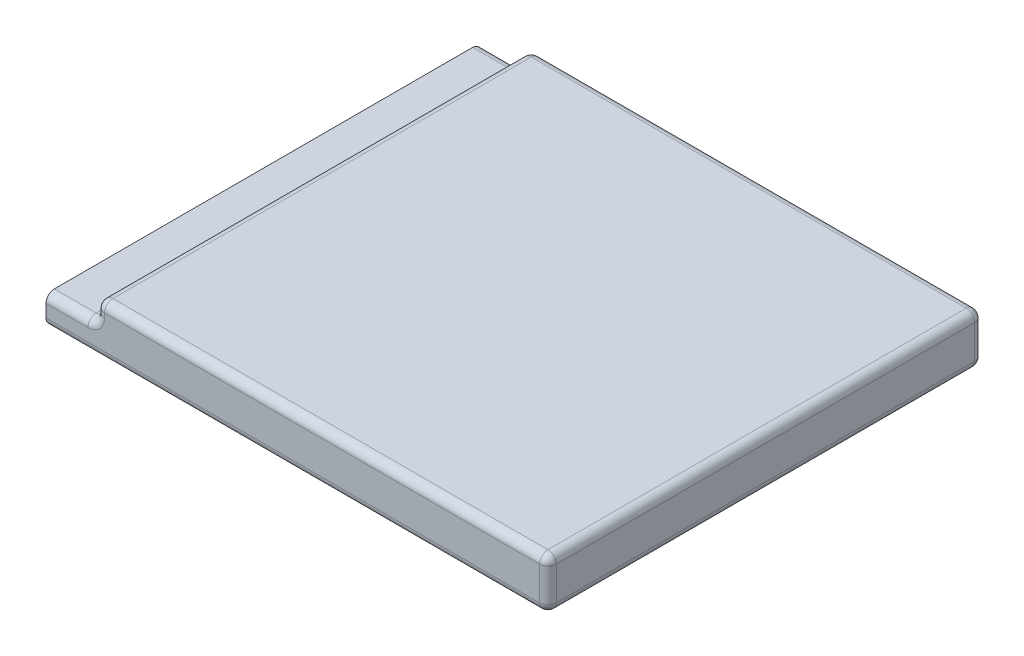
from build123d import *

# Parameters (mm, degrees)
SKETCH2_W           = 60
SKETCH2_H           = 52
BOSS_EXTRUDE1_DEPTH = 6
SKETCH3_W           = 6
SKETCH3_H           = 52
CUT_EXTRUDE1_DEPTH  = 2.5
FILLET1_R           = 1


with BuildPart() as part:
    # Sketch2 → Boss-Extrude1 (new body)
    with BuildSketch(Plane(origin=(0, 0, 0), x_dir=(1, 0, 0), z_dir=(0, 1, 0))):
        with Locations((11.121057716, -5.523608753)):
            Rectangle(SKETCH2_W, SKETCH2_H)
    extrude(amount=BOSS_EXTRUDE1_DEPTH)

    # Sketch3 → Cut-Extrude1 (cut)
    with BuildSketch(Plane(origin=(0, 6, 0), x_dir=(1, 0, 0), z_dir=(0, 1, 0))):
        with Locations((-15.878942284, -5.523608753)):
            Rectangle(SKETCH3_W, SKETCH3_H)
    extrude(amount=-CUT_EXTRUDE1_DEPTH, mode=Mode.SUBTRACT)

    # Fillet1
    fillet1_edges = [part.edges().sort_by_distance(p)[0] for p in [
        (41.121057716, 6, 5.523608753),
        (14.121057716, 6, -20.476391247),
        (14.121057716, 6, 31.523608753),
        (-12.878942284, 3.5, 5.523608753),
        (-12.878942284, 4.75, -20.476391247),
        (-15.878942284, 3.5, 31.523608753),
        (-12.878942284, 4.75, 31.523608753),
        (-15.878942284, 3.5, -20.476391247),
        (-12.878942284, 6, 5.523608753),
        (11.121057716, 0, -20.476391247),
        (41.121057716, 0, 5.523608753),
        (11.121057716, 0, 31.523608753),
        (41.121057716, 3, -20.476391247),
        (41.121057716, 3, 31.523608753),
    ]]
    fillet(fillet1_edges, radius=FILLET1_R)


solid = part.part
